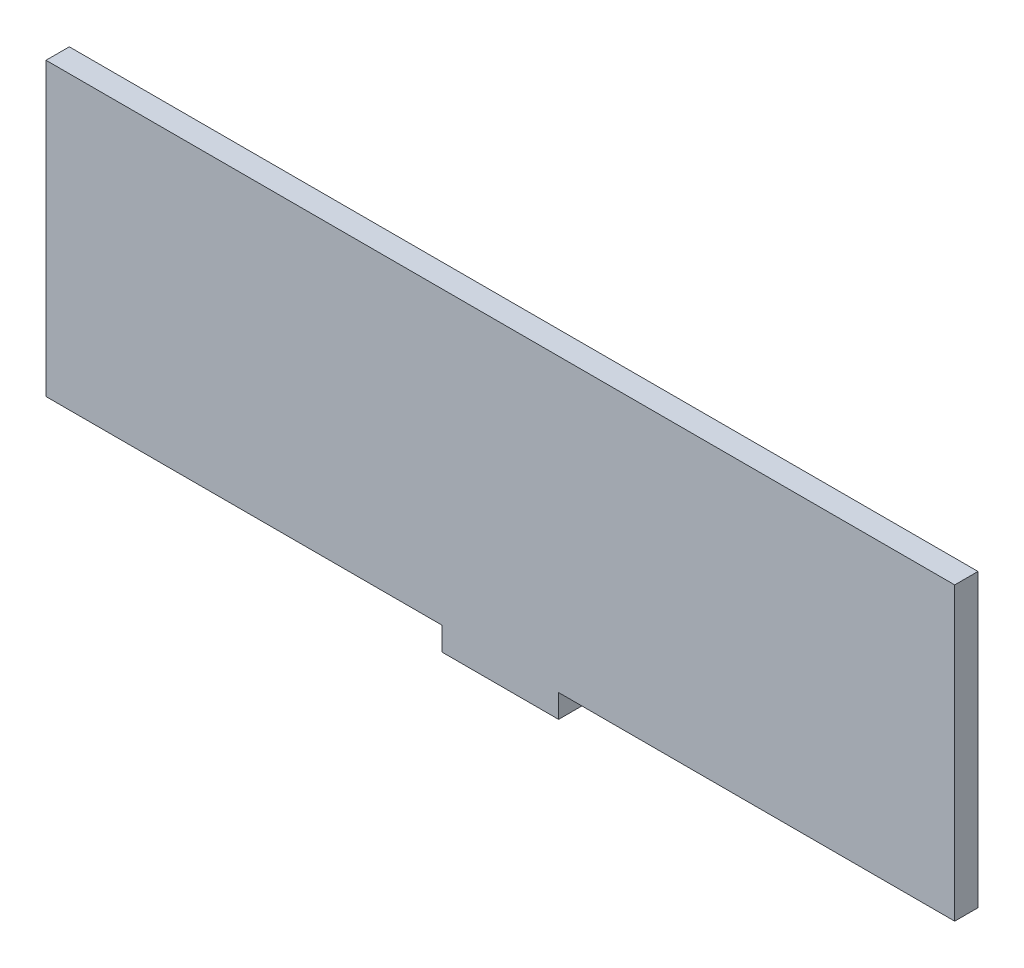
from build123d import *

# Parameters (mm, degrees)
EXTRUDE_1_DEPTH = 2


with BuildPart() as part:
    # 草图1 → 凸台-拉伸1 (new body)
    with BuildSketch(Plane.XY):
        Polygon((-39, -12.5), (-5, -12.5), (-5, -14.5), (5, -14.5), (5, -12.5), (39, -12.5), (39, 12.5), (5, 12.5), (-5, 12.5), (-39, 12.5), align=None)
    extrude(amount=EXTRUDE_1_DEPTH)


solid = part.part
